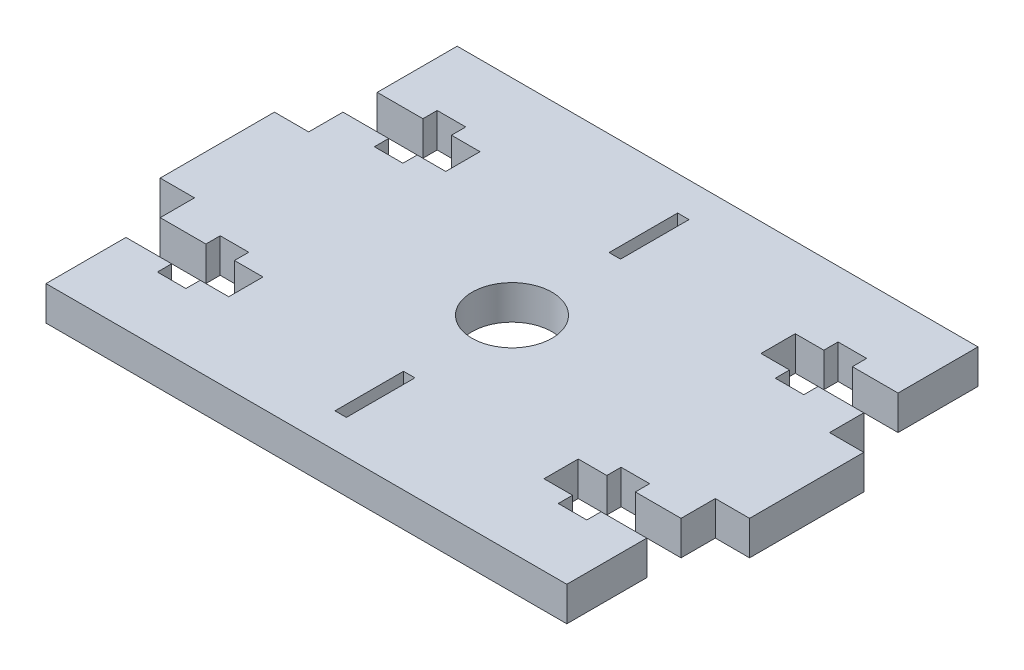
from build123d import *

# Parameters (mm, degrees)
ESBO_O4_R                = 3.5
RESSALTO_EXTRUS_O1_DEPTH = 3


with BuildPart() as part:
    # Esboço4 → Ressalto-extrusão1 (new body)
    with BuildSketch(Plane(origin=(0, 0, 0), x_dir=(1, 0, 0), z_dir=(0, 1, 0))):
        Polygon((19.1, 6.75), (16.6, 6.75), (16.6, 8), (14.1, 8), (14.1, 11), (16.6, 11), (16.6, 12.25), (19.1, 12.25), (19.1, 11), (23.1, 11), (23.1, 18), (-0.5, 18), (-22.5, 18), (-22.5, 11), (-18.5, 11), (-18.5, 12.25), (-16, 12.25), (-16, 11), (-13.5, 11), (-13.5, 8), (-16, 8), (-16, 6.75), (-18.5, 6.75), (-18.5, 8), (-22.5, 8), (-22.5, 5), (-25.5, 5), (-25.5, -5), (-22.5, -5), (-22.5, -8), (-18.5, -8), (-18.5, -6.75), (-16, -6.75), (-16, -8), (-13.5, -8), (-13.5, -11), (-16, -11), (-16, -12.25), (-18.5, -12.25), (-18.5, -11), (-22.5, -11), (-22.5, -18), (-0.5, -18), (23.1, -18), (23.1, -11), (19.1, -11), (19.1, -12.25), (16.6, -12.25), (16.6, -11), (14.1, -11), (14.1, -8), (16.6, -8), (16.6, -6.75), (19.1, -6.75), (19.1, -8), (23.1, -8), (23.1, -5), (26.1, -5), (26.1, 5), (23.1, 5), (23.1, 8), (19.1, 8), align=None)
        with Locations(Location((0.3, 0, 0), (0, 0, 270))):
            Circle(ESBO_O4_R, mode=Mode.SUBTRACT)
        Polygon((0.3, -15), (-0.2, -15), (-0.2, -9), (0.8, -9), (0.8, -15), align=None, mode=Mode.SUBTRACT)
        Polygon((0.8, 15), (0.3, 15), (-0.2, 15), (-0.2, 9), (0.8, 9), align=None, mode=Mode.SUBTRACT)
    extrude(amount=RESSALTO_EXTRUS_O1_DEPTH)


solid = part.part
